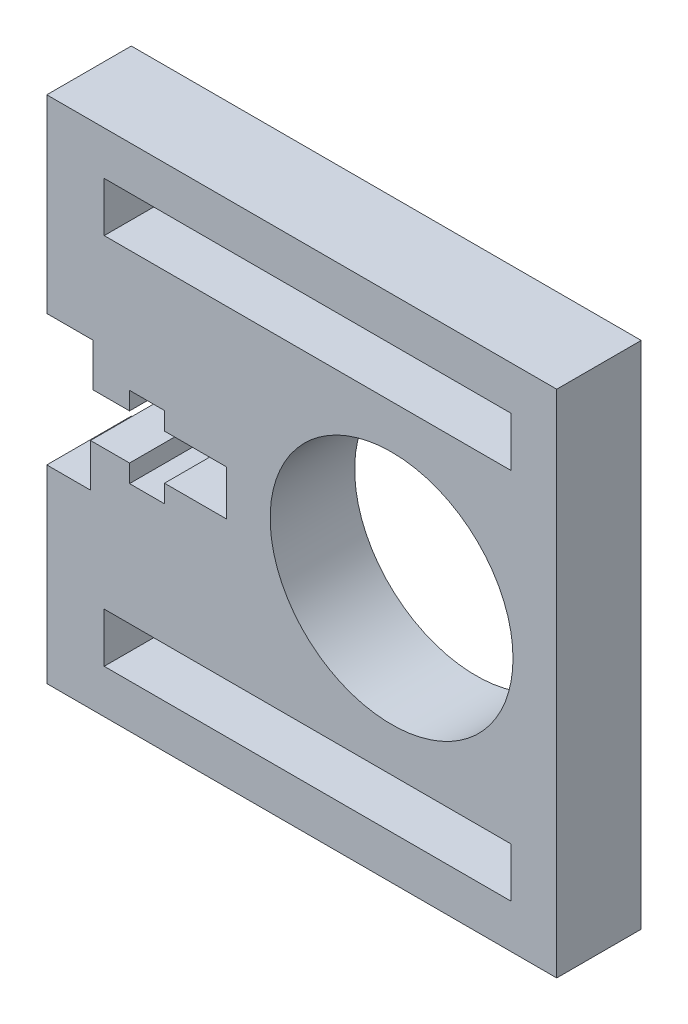
from build123d import *

# Parameters (mm, degrees)
SKETCH1_RX          = 8.334694939
SKETCH1_RY          = 8.1
SKETCH1_W           = 27.929114048
SKETCH1_H           = 3.401184302
SKETCH1_H_2         = 3.401184301
BOSS_EXTRUDE1_DEPTH = 5.8


with BuildPart() as part:
    # Sketch1 → Boss-Extrude1 (new body)
    with BuildSketch(Plane.XY):
        Polygon((-5.45496555, 25.036590129), (-5.45496555, 28.132290129), (-9.705575673, 28.132290129), (-9.705575673, 29.356690129), (-12.105575673, 29.356690129), (-12.105575673, 28.132290129), (-14.605575673, 28.132290129), (-14.605575673, 31.084440129), (-17.785575673, 31.084440129), (-17.785575673, 44.084440129), (17.214424327, 44.084440129), (17.214424327, 9.084440129), (-17.785575673, 9.084440129), (-17.785575673, 22.084440129), (-14.785575673, 22.084440129), (-14.785575673, 25.036590129), (-12.105575673, 25.036590129), (-12.105575673, 23.812190129), (-9.705575673, 23.812190129), (-9.705575673, 25.036590129), align=None)
        with Locations((5.879729388, 26.584440129)):
            Ellipse(SKETCH1_RX, SKETCH1_RY, mode=Mode.SUBTRACT)
        with Locations((0.120011131, 39.38503228)):
            Rectangle(SKETCH1_W, SKETCH1_H, mode=Mode.SUBTRACT)
        with Locations((0.120011131, 13.783847979)):
            Rectangle(SKETCH1_W, SKETCH1_H_2, mode=Mode.SUBTRACT)
    extrude(amount=BOSS_EXTRUDE1_DEPTH)


solid = part.part
